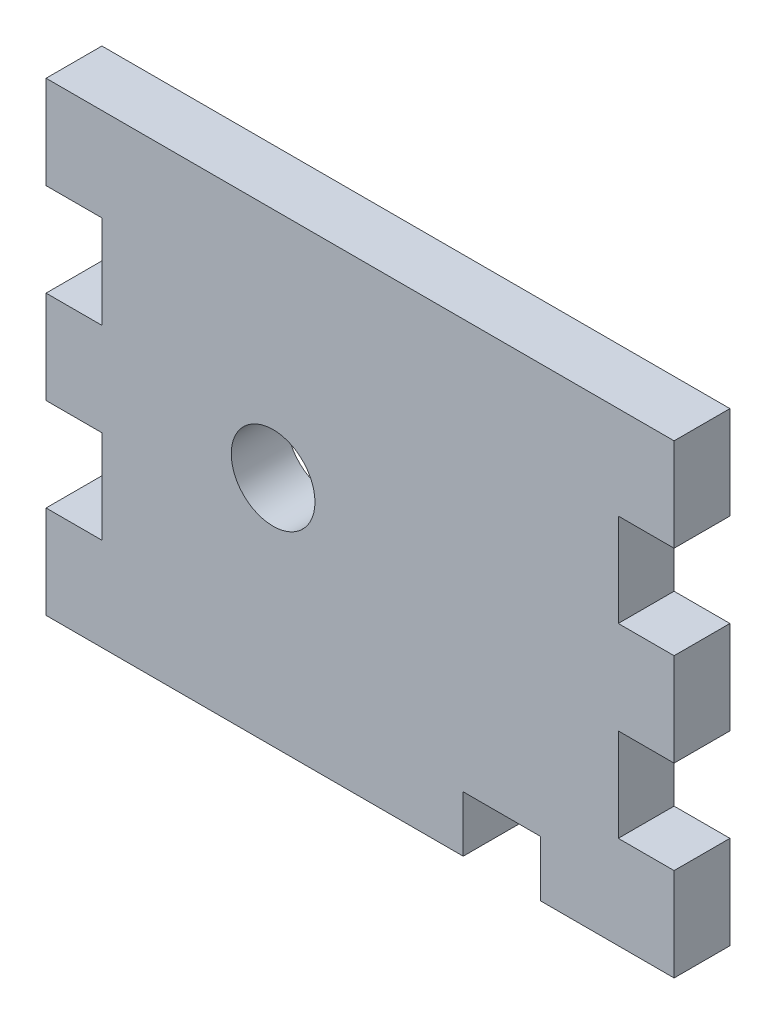
from build123d import *

# Parameters (mm, degrees)
SKETCH1_W           = 171.45
SKETCH1_H           = 127
BOSS_EXTRUDE1_DEPTH = 15.24
SKETCH5_W           = 15.24
SKETCH5_H           = 25.4
CUT_EXTRUDE1_DEPTH  = 15.24
SKETCH11_R          = 11.43
CUT_EXTRUDE3_DEPTH  = 15.24
SKETCH7_W           = 21.166666666
SKETCH7_H           = 15.24
CUT_EXTRUDE4_DEPTH  = 15.24


with BuildPart() as part:
    # Sketch1 → Boss-Extrude1 (new body)
    with BuildSketch(Plane.XY):
        with Locations((85.725, 63.5)):
            Rectangle(SKETCH1_W, SKETCH1_H)
    extrude(amount=BOSS_EXTRUDE1_DEPTH)

    # Sketch5 → Cut-Extrude1 (cut)
    with BuildSketch(Plane.XY.offset(15.24)):
        with Locations((7.62, 88.9)):
            Rectangle(SKETCH5_W, SKETCH5_H)
        with Locations((7.62, 38.1)):
            Rectangle(SKETCH5_W, SKETCH5_H)
        with Locations((163.83, 88.9)):
            Rectangle(SKETCH5_W, SKETCH5_H)
        with Locations((163.83, 38.1)):
            Rectangle(SKETCH5_W, SKETCH5_H)
    extrude(amount=-CUT_EXTRUDE1_DEPTH, mode=Mode.SUBTRACT)

    # Sketch11 → Cut-Extrude3 (cut)
    with BuildSketch(Plane.XY.offset(15.24)):
        with Locations((61.976, 63.5)):
            Circle(SKETCH11_R)
    extrude(amount=-CUT_EXTRUDE3_DEPTH, mode=Mode.SUBTRACT)

    # Sketch7 → Cut-Extrude4 (cut)
    with BuildSketch(Plane.XY.offset(15.24)):
        with Locations((124.46, 7.62)):
            Rectangle(SKETCH7_W, SKETCH7_H)
    extrude(amount=-CUT_EXTRUDE4_DEPTH, mode=Mode.SUBTRACT)


solid = part.part
